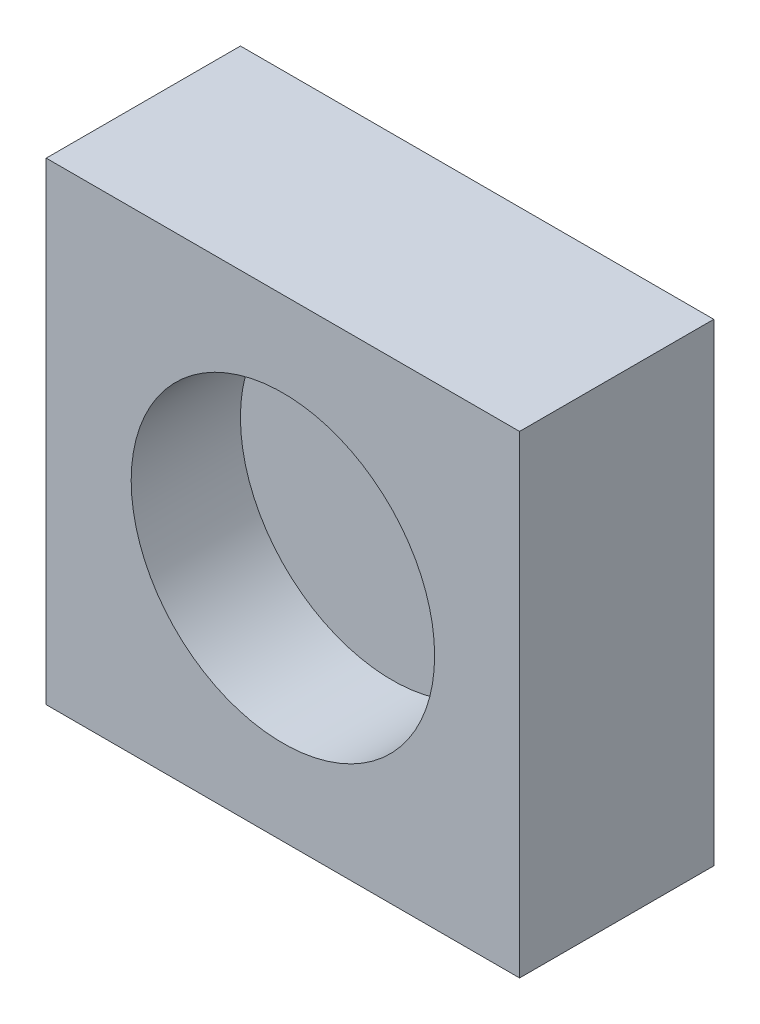
from build123d import *

# Parameters (mm, degrees)
SKETCH_1_W          = 7.8
SKETCH_1_H          = 7.8
EXTRUDE_1_DEPTH     = 3.2
SKETCH_2_R          = 2.5
CUT_EXTRUDE_1_DEPTH = 1.8


with BuildPart() as part:
    # Эскиз1 → Бобышка-Вытянуть1 (new body)
    with BuildSketch(Plane.XY):
        Rectangle(SKETCH_1_W, SKETCH_1_H)
    extrude(amount=EXTRUDE_1_DEPTH)

    # Эскиз2 → Вырез-Вытянуть1 (cut)
    with BuildSketch(Plane.XY.offset(3.2)):
        Circle(SKETCH_2_R)
    extrude(amount=-CUT_EXTRUDE_1_DEPTH, mode=Mode.SUBTRACT)


solid = part.part
